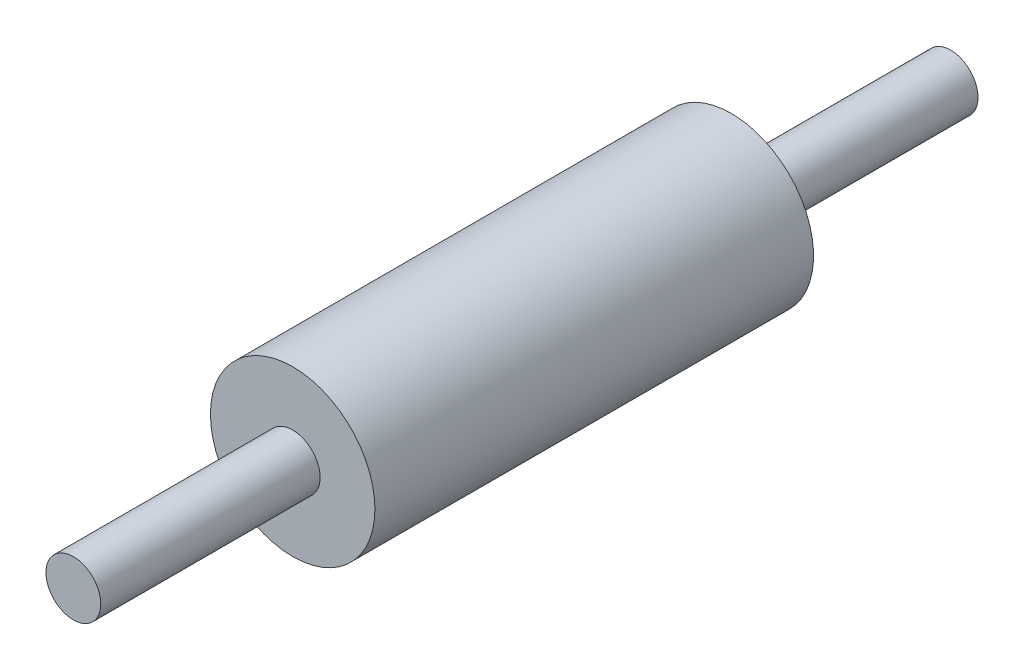
from build123d import *

# Parameters (mm, degrees)
CROQUIS1_R                   = 15
SALIENTE_EXTRUIR1_DEPTH      = 160
CROQUIS2_R                   = 15
CROQUIS2_R_2                 = 5
CORTAR_EXTRUIR_L_MINA1_DEPTH = 40
CORTAR_EXTRUIR_L_MINA2_START = -40
CROQUIS3_R                   = 15
CROQUIS3_R_2                 = 5
CORTAR_EXTRUIR_L_MINA2_DEPTH = 40


with BuildPart() as part:
    # Croquis1 → Saliente-Extruir1 (new body)
    with BuildSketch(Plane.XY):
        Circle(CROQUIS1_R)
    extrude(amount=SALIENTE_EXTRUIR1_DEPTH)

    # Croquis2 → Cortar-Extruir-Lámina1 (cut)
    with BuildSketch(Plane(origin=(0, 0, 0), x_dir=(-1, 0, 0), z_dir=(0, 0, -1))):
        Circle(CROQUIS2_R)
        Circle(CROQUIS2_R_2, mode=Mode.SUBTRACT)
    extrude(amount=-CORTAR_EXTRUIR_L_MINA1_DEPTH, mode=Mode.SUBTRACT)

    # Croquis3 → Cortar-Extruir-Lámina2 (cut)
    with BuildSketch(Plane.XY.offset(160).offset(CORTAR_EXTRUIR_L_MINA2_START)):
        Circle(CROQUIS3_R)
        Circle(CROQUIS3_R_2, mode=Mode.SUBTRACT)
    extrude(amount=CORTAR_EXTRUIR_L_MINA2_DEPTH, mode=Mode.SUBTRACT)


solid = part.part
